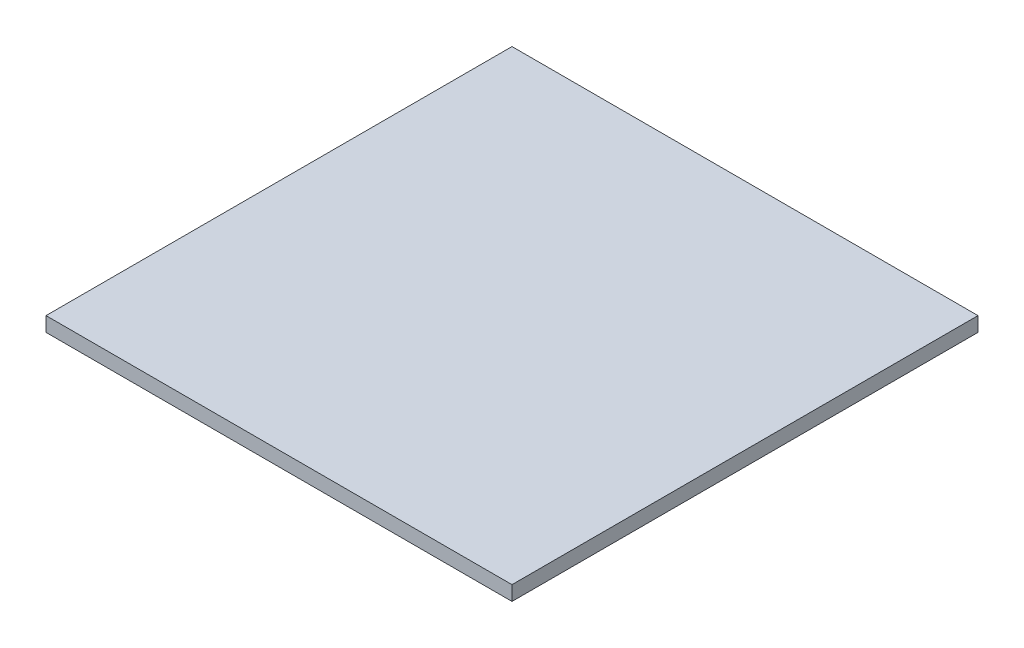
from build123d import *

# Parameters (mm, degrees)
BOSS_EXTRUDE1_DEPTH = 6.35


with BuildPart() as part:
    # 3DSketch1 → Boss-Extrude1 (new body)
    with BuildSketch(Plane(origin=(101.6, 0, -25.4), x_dir=(-0.7071067811865476, 0, -0.7071067811865476), z_dir=(0, -1, 0))):
        Polygon((0, 0), (143.684097937, 143.684097937), (287.368195874, 0), (143.684097937, -143.684097937), align=None)
    extrude(amount=-BOSS_EXTRUDE1_DEPTH)


solid = part.part
